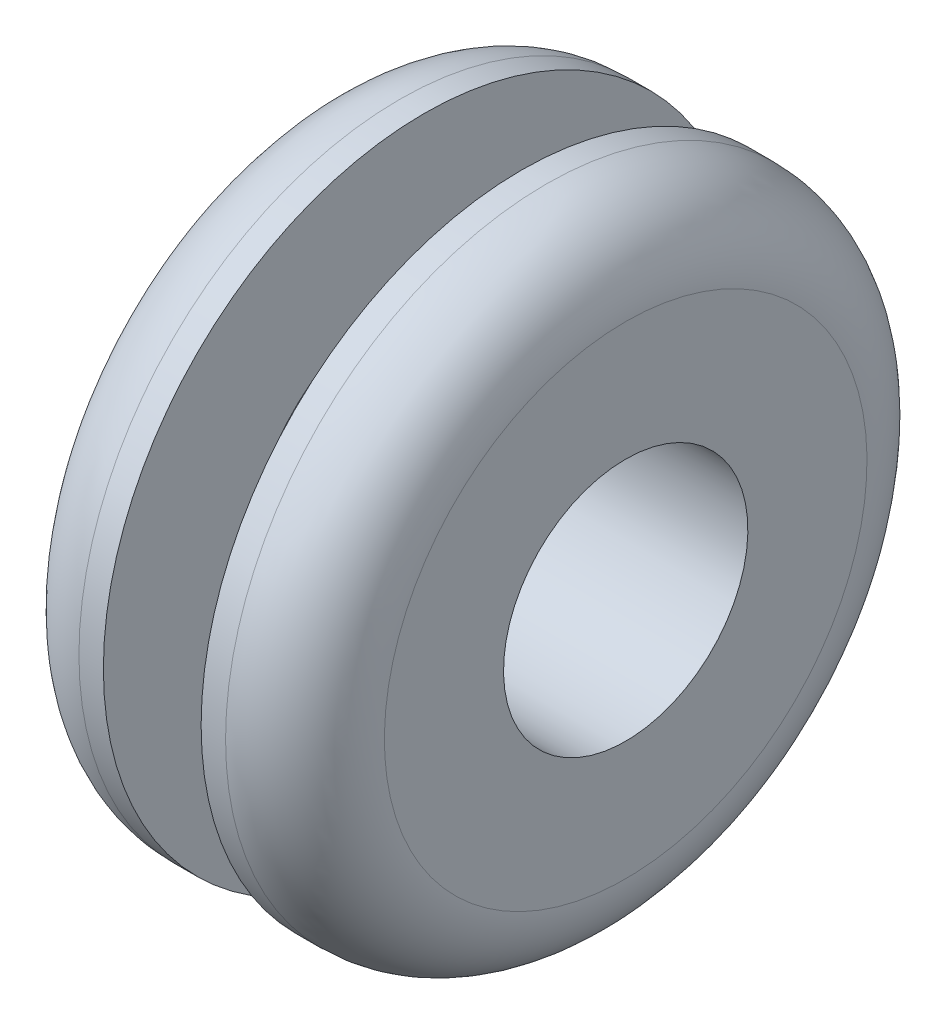
from build123d import *

# Parameters (mm, degrees)
FILLET_1_R = 1.3


with BuildPart() as part:
    # Эскиз1 → Повернуть1 (revolve)
    with BuildSketch(Plane.XY):
        Polygon((-0.8, 1), (0.8, 1), (0.8, 3.25), (2.5, 3.25), (2.5, 0), (-2.5, 0), (-2.5, 3.25), (-0.8, 3.25), align=None)
    revolve(axis=Axis((0, -2, 0), (-1, 0, 0)))

    # Скругление1
    fillet_1_edges = [part.edges().sort_by_distance(p)[0] for p in [
        (2.5, -7.25, 0),
        (-2.5, -7.25, 0),
    ]]
    fillet(fillet_1_edges, radius=FILLET_1_R)


solid = part.part
